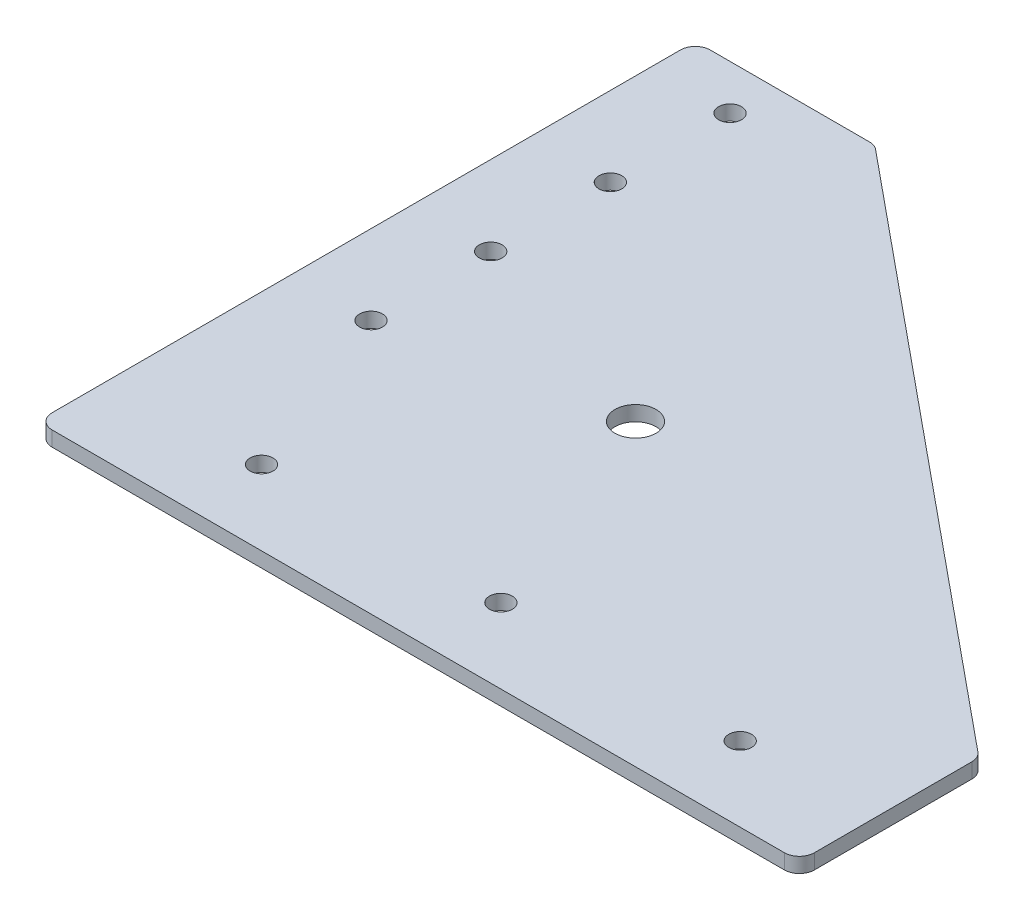
from build123d import *

# Parameters (mm, degrees)
SKETCH1_R           = 2.4257
BOSS_EXTRUDE1_DEPTH = 3.175
FILLET1_R           = 3.175
SKETCH2_R           = 4.3688
CUT_EXTRUDE1_DEPTH  = 214.780566999


with BuildPart() as part:
    # Sketch1 → Boss-Extrude1 (new body)
    with BuildSketch(Plane(origin=(0, 0, 0), x_dir=(1, 0, 0), z_dir=(0, 1, 0))):
        Polygon((0, 0), (0, 139.7), (38.1, 139.7), (161.789864335, 38.1), (161.789864335, 0), align=None)
        with Locations(Location((31.75, 15.875, 0), (0, 0, 270))):
            Circle(SKETCH1_R, mode=Mode.SUBTRACT)
        with Locations(Location((82.55, 15.875, 0), (0, 0, 270))):
            Circle(SKETCH1_R, mode=Mode.SUBTRACT)
        with Locations(Location((133.35, 15.875, 0), (0, 0, 270))):
            Circle(SKETCH1_R, mode=Mode.SUBTRACT)
        with Locations(Location((16.891, 53.975, 0), (0, 0, 270))):
            Circle(SKETCH1_R, mode=Mode.SUBTRACT)
        with Locations(Location((16.891, 79.375, 0), (0, 0, 270))):
            Circle(SKETCH1_R, mode=Mode.SUBTRACT)
        with Locations(Location((16.891, 104.775, 0), (0, 0, 270))):
            Circle(SKETCH1_R, mode=Mode.SUBTRACT)
        with Locations(Location((16.891, 130.175, 0), (0, 0, 270))):
            Circle(SKETCH1_R, mode=Mode.SUBTRACT)
    extrude(amount=BOSS_EXTRUDE1_DEPTH)

    # Fillet1
    fillet1_edges = [part.edges().sort_by_distance(p)[0] for p in [
        (0, 1.5875, 0),
        (0, 1.5875, -139.7),
        (38.1, 1.5875, -139.7),
        (161.789864335, 1.5875, -38.1),
        (161.789864335, 1.5875, 0),
    ]]
    fillet(fillet1_edges, radius=FILLET1_R)

    # Sketch2 → Cut-Extrude1 (cut, through all)
    with BuildSketch(Plane(origin=(0, 3.175, 0), x_dir=(1, 0, 0), z_dir=(0, 1, 0))):
        with Locations(Location((63.5, 63.5, 0), (0, 0, 270))):
            Circle(SKETCH2_R)
    extrude(amount=-CUT_EXTRUDE1_DEPTH, mode=Mode.SUBTRACT)


solid = part.part
